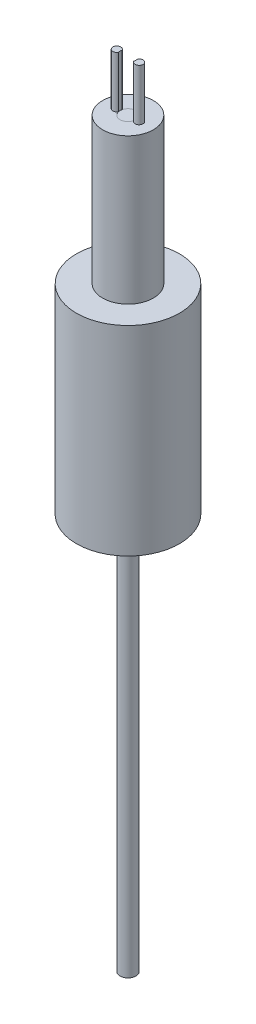
from build123d import *

# Parameters (mm, degrees)
BOSS_EXTRUDE1_DEPTH      = 50.1
BOSS_EXTRUDE1_2_DEPTH    = 50.1
SKETCH1_3_R              = 3.2
BOSS_EXTRUDE2_DEPTH      = 43.6
SKETCH1_4_R              = 6.5
SKETCH1_4_R_2            = 3.2
BOSS_EXTRUDE3_DEPTH      = 25.2
BOSS_EXTRUDE4_DEPTH      = 43.6
BOSS_EXTRUDE4_DEPTH_BACK = 50
SKETCH1_5_R              = 1


with BuildPart() as part:
    # Sketch1 → Boss-Extrude1 (new body)
    with BuildSketch(Plane(origin=(0, 0, 0), x_dir=(1, 0, 0), z_dir=(0, 1, 0))):
        with BuildLine():
            ThreePointArc((0.96969231, -0.244329336), (1.905929832, 0), (0.96969231, 0.244329336))
            ThreePointArc((0.96969231, 0.244329336), (1, 0), (0.96969231, -0.244329336))
        make_face()
    extrude(amount=BOSS_EXTRUDE1_DEPTH)



with BuildPart() as body_2:
    # Sketch1 → Boss-Extrude1 2 (new body)
    with BuildSketch(Plane(origin=(0, 0, 0), x_dir=(1, 0, 0), z_dir=(0, 1, 0))):
        with BuildLine():
            ThreePointArc((-0.96969231, -0.244329336), (-1, 0), (-0.96969231, 0.244329336))
            ThreePointArc((-0.96969231, 0.244329336), (-1.905929832, 0), (-0.96969231, -0.244329336))
        make_face()
    extrude(amount=BOSS_EXTRUDE1_2_DEPTH)


with BuildPart() as part_1:
    add(part.part)

    add(body_2.part)  # Boss-Extrude2 merges body 2
    # Sketch1<3> → Boss-Extrude2 (add)
    with BuildSketch(Plane(origin=(0, 0, 0), x_dir=(1, 0, 0), z_dir=(0, 1, 0))):
        Circle(SKETCH1_3_R)
        with BuildLine():
            ThreePointArc((0.96969231, 0.244329336), (1.532185998, 0.483796838), (1.905929832, 0))
            ThreePointArc((1.905929832, 0), (1.532185998, -0.483796838), (0.96969231, -0.244329336))
            ThreePointArc((0.96969231, -0.244329336), (0, -1), (-0.96969231, -0.244329336))
            ThreePointArc((-0.96969231, -0.244329336), (-1.905929832, 0), (-0.96969231, 0.244329336))
            ThreePointArc((-0.96969231, 0.244329336), (0, 1), (0.96969231, 0.244329336))
        make_face(mode=Mode.SUBTRACT)
    extrude(amount=BOSS_EXTRUDE2_DEPTH)

    # Sketch1<4> → Boss-Extrude3 (add)
    with BuildSketch(Plane(origin=(0, 0, 0), x_dir=(1, 0, 0), z_dir=(0, 1, 0))):
        Circle(SKETCH1_4_R)
        Circle(SKETCH1_4_R_2, mode=Mode.SUBTRACT)
    extrude(amount=BOSS_EXTRUDE3_DEPTH)


with BuildPart() as body_2_2:
    # Sketch1<5> → Boss-Extrude4 (new, two sides: drawn at the far end of the back side and taken through both)
    with BuildSketch(Plane(origin=(0, 0, 0), x_dir=(1, 0, 0), z_dir=(0, 1, 0)).offset(-BOSS_EXTRUDE4_DEPTH_BACK)):
        Circle(SKETCH1_5_R)
    extrude(amount=BOSS_EXTRUDE4_DEPTH + BOSS_EXTRUDE4_DEPTH_BACK)


solid = Compound([part_1.part, body_2_2.part])
